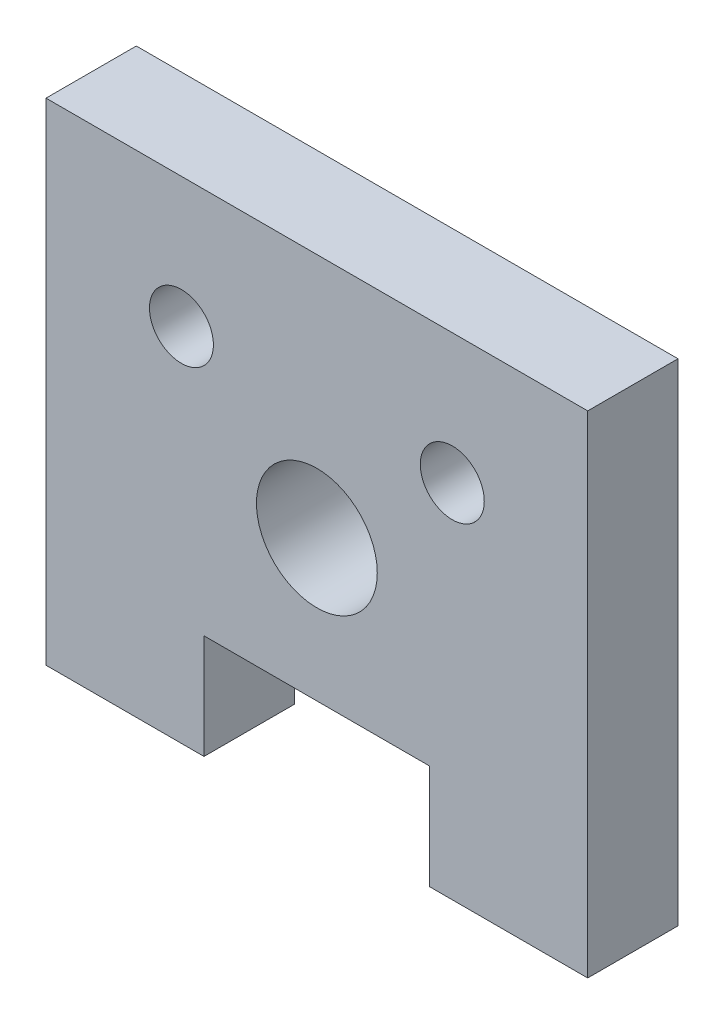
from build123d import *

# Parameters (mm, degrees)
SKETCH1_R           = 8.5
SKETCH1_R_2         = 4.5
BOSS_EXTRUDE1_DEPTH = 12.7


with BuildPart() as part:
    # Sketch1 → Boss-Extrude1 (new body)
    with BuildSketch(Plane.XY):
        Polygon((-15.875, -34.544), (-15.875, -19.844), (15.875, -19.844), (15.875, -34.544), (38.1, -34.544), (38.1, 34.544), (-38.1, 34.544), (-38.1, -34.544), align=None)
        Circle(SKETCH1_R, mode=Mode.SUBTRACT)
        with Locations((19.05, 16.256)):
            Circle(SKETCH1_R_2, mode=Mode.SUBTRACT)
        with Locations((-19.05, 16.256)):
            Circle(SKETCH1_R_2, mode=Mode.SUBTRACT)
    extrude(amount=BOSS_EXTRUDE1_DEPTH)


solid = part.part
